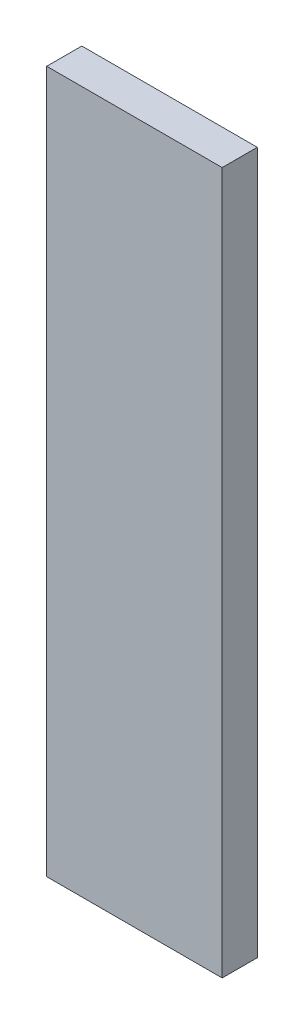
from build123d import *

# Parameters (mm, degrees)
SKETCH1_W           = 30
SKETCH1_H           = 120
BOSS_EXTRUDE1_DEPTH = 6


with BuildPart() as part:
    # Sketch1 → Boss-Extrude1 (new body)
    with BuildSketch(Plane.XY):
        Rectangle(SKETCH1_W, SKETCH1_H)
    extrude(amount=BOSS_EXTRUDE1_DEPTH)


solid = part.part
